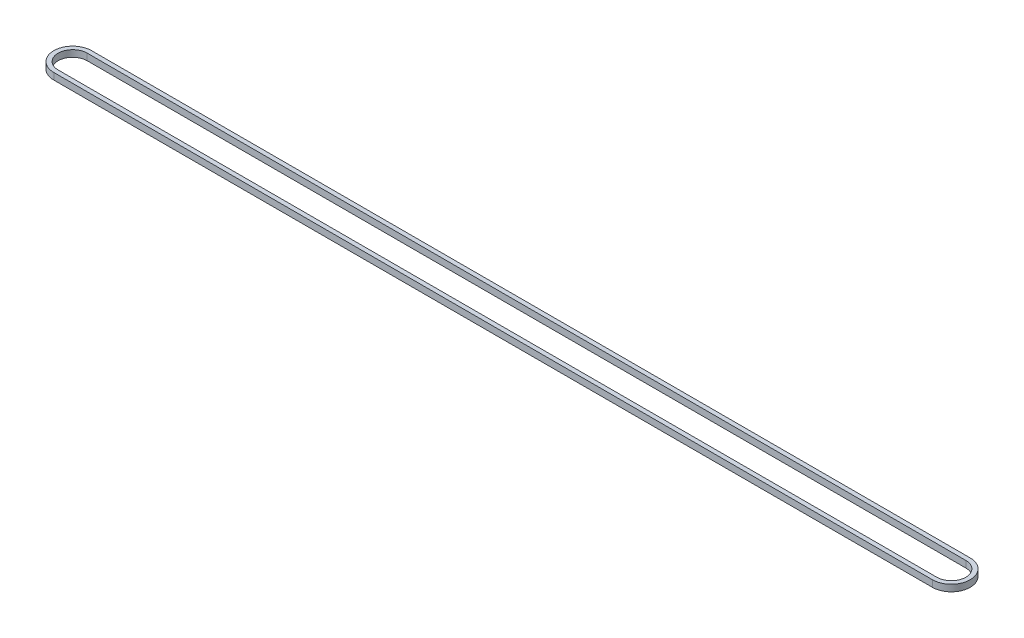
from build123d import *

# Parameters (mm, degrees)
BOSS_EXTRUDE1_DEPTH = 8.89


with BuildPart() as part:
    # Sketch1 → Boss-Extrude1 (new body)
    with BuildSketch(Plane(origin=(0, 0, 0), x_dir=(1, 0, 0), z_dir=(0, 1, 0))):
        with BuildLine():
            Line((0, 25.4), (1181.1, 25.4))
            ThreePointArc((1181.1, 25.4), (1206.5, 0), (1181.1, -25.4))
            Line((1181.1, -25.4), (0, -25.4))
            ThreePointArc((0, -25.4), (-25.4, 0), (0, 25.4))
        make_face()
        with BuildLine():
            Line((0, 19.558), (1181.1, 19.558))
            ThreePointArc((1181.1, 19.558), (1200.658, 0), (1181.1, -19.558))
            Line((1181.1, -19.558), (0, -19.558))
            ThreePointArc((0, -19.558), (-19.558, 0), (0, 19.558))
        make_face(mode=Mode.SUBTRACT)
    extrude(amount=BOSS_EXTRUDE1_DEPTH)


solid = part.part
